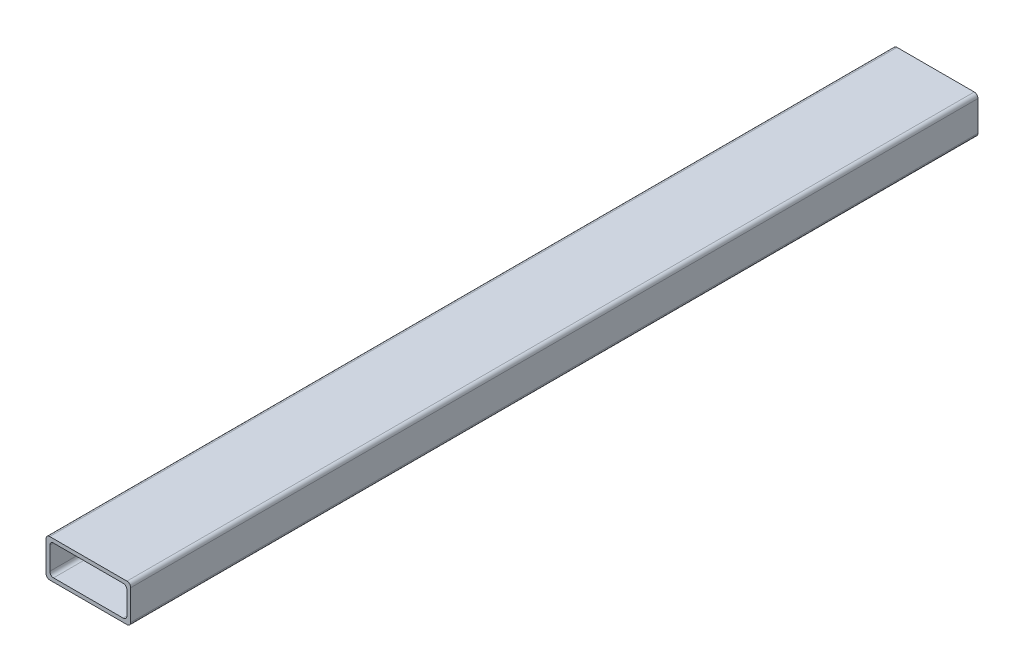
from build123d import *

# Parameters (mm, degrees)
BOSS_EXTRUDE1_DEPTH = 450


with BuildPart() as part:
    # Sketch1 → Boss-Extrude1 (new body)
    with BuildSketch(Plane.XY):
        with BuildLine():
            Line((-67.078119423, 7.732625309), (-26.078119423, 7.732625309))
            ThreePointArc((-26.078119423, 7.732625309), (-24.663905861, 8.318411746), (-24.078119423, 9.732625309))
            Line((-24.078119423, 9.732625309), (-24.078119423, 25.732625309))
            ThreePointArc((-24.078119423, 25.732625309), (-24.663905861, 27.146838871), (-26.078119423, 27.732625309))
            Line((-26.078119423, 27.732625309), (-67.078119423, 27.732625309))
            ThreePointArc((-67.078119423, 27.732625309), (-68.492332986, 27.146838871), (-69.078119423, 25.732625309))
            Line((-69.078119423, 25.732625309), (-69.078119423, 9.732625309))
            ThreePointArc((-69.078119423, 9.732625309), (-68.492332986, 8.318411746), (-67.078119423, 7.732625309))
        make_face()
        with BuildLine():
            Line((-26.078119423, 23.732625309), (-26.078119423, 11.732625309))
            ThreePointArc((-26.078119423, 11.732625309), (-26.663905861, 10.318411746), (-28.078119423, 9.732625309))
            Line((-28.078119423, 9.732625309), (-65.078119423, 9.732625309))
            ThreePointArc((-65.078119423, 9.732625309), (-66.492332986, 10.318411746), (-67.078119423, 11.732625309))
            Line((-67.078119423, 11.732625309), (-67.078119423, 23.732625309))
            ThreePointArc((-67.078119423, 23.732625309), (-66.492332986, 25.146838871), (-65.078119423, 25.732625309))
            Line((-65.078119423, 25.732625309), (-28.078119423, 25.732625309))
            ThreePointArc((-28.078119423, 25.732625309), (-26.663905861, 25.146838871), (-26.078119423, 23.732625309))
        make_face(mode=Mode.SUBTRACT)
    extrude(amount=BOSS_EXTRUDE1_DEPTH)


solid = part.part
